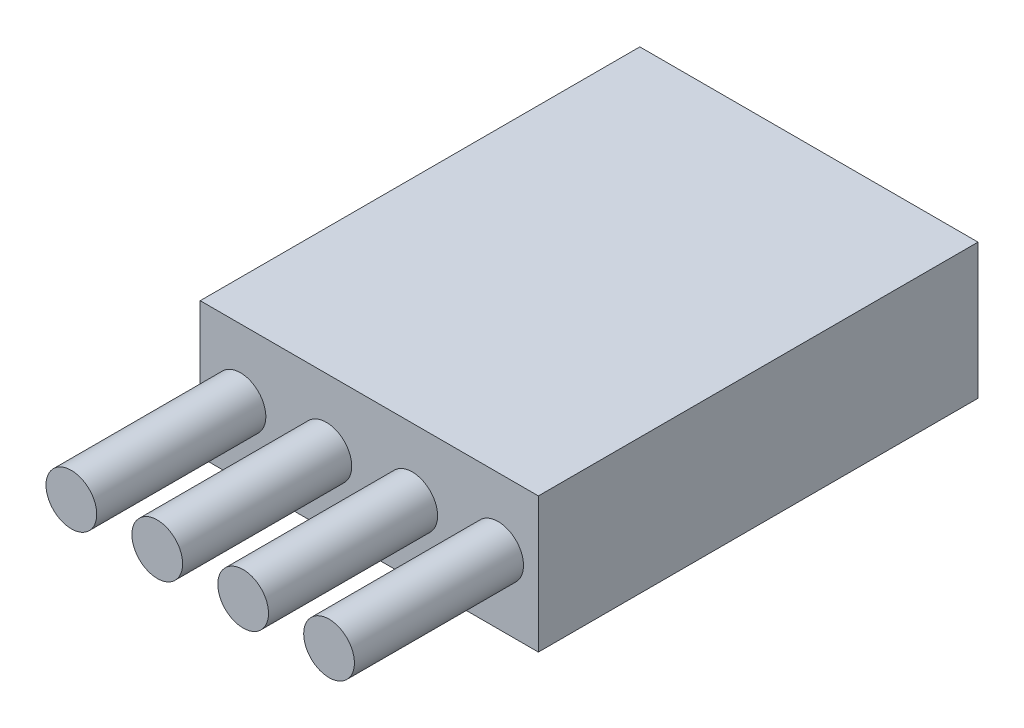
from build123d import *

# Parameters (mm, degrees)
SKETCH1_W           = 10
SKETCH1_H           = 13
BOSS_EXTRUDE1_DEPTH = 4
SKETCH2_R           = 0.75
BOSS_EXTRUDE2_DEPTH = 5


with BuildPart() as part:
    # Sketch1 → Boss-Extrude1 (new body)
    with BuildSketch(Plane(origin=(0, 0, 0), x_dir=(1, 0, 0), z_dir=(0, 1, 0))):
        Rectangle(SKETCH1_W, SKETCH1_H)
    extrude(amount=BOSS_EXTRUDE1_DEPTH)

    # Sketch2 → Boss-Extrude2 (add)
    with BuildSketch(Plane.XY.offset(6.5)):
        with Locations(Location((-3.81, 2, 0), (0, 0, 180))):
            Circle(SKETCH2_R)
        with Locations(Location((-1.27, 2, 0), (0, 0, 180))):
            Circle(SKETCH2_R)
        with Locations(Location((1.27, 2, 0), (0, 0, 180))):
            Circle(SKETCH2_R)
        with Locations(Location((3.81, 2, 0), (0, 0, 180))):
            Circle(SKETCH2_R)
    extrude(amount=BOSS_EXTRUDE2_DEPTH)


solid = part.part
